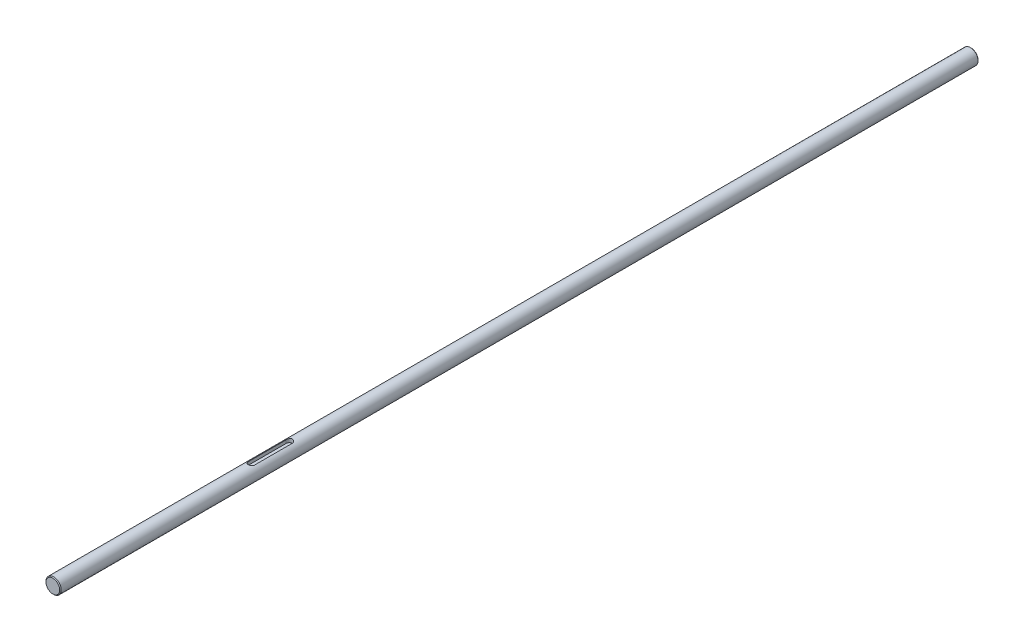
from build123d import *

# Parameters (mm, degrees)
SKETCH_1_R          = 5
EXTRUDE_1_DEPTH     = 602
CHAMFER_1_SIZE      = 0.5
CUT_EXTRUDE_2_DEPTH = 10


with BuildPart() as part:
    # 草图1 → 拉伸1 (new body)
    with BuildSketch(Plane.XY):
        Circle(SKETCH_1_R)
    extrude(amount=EXTRUDE_1_DEPTH)

    # 倒角1
    chamfer_1_edges = [part.edges().sort_by_distance(p)[0] for p in [
        (-5, 0, 0),
        (-5, 0, 602),
    ]]
    chamfer(chamfer_1_edges, length=CHAMFER_1_SIZE)

    # 草图2 → 拉伸2 (cut)
    with BuildSketch(Plane(origin=(0, 2.5, 0), x_dir=(-1, 0, 0), z_dir=(0, 1, 0))):
        with BuildLine():
            Line((2, 472), (2, 447))
            ThreePointArc((2, 447), (0, 445), (-2, 447))
            Line((-2, 447), (-2, 472))
            ThreePointArc((-2, 472), (0, 474), (2, 472))
        make_face()
    extrude(amount=CUT_EXTRUDE_2_DEPTH, mode=Mode.SUBTRACT)


solid = part.part
